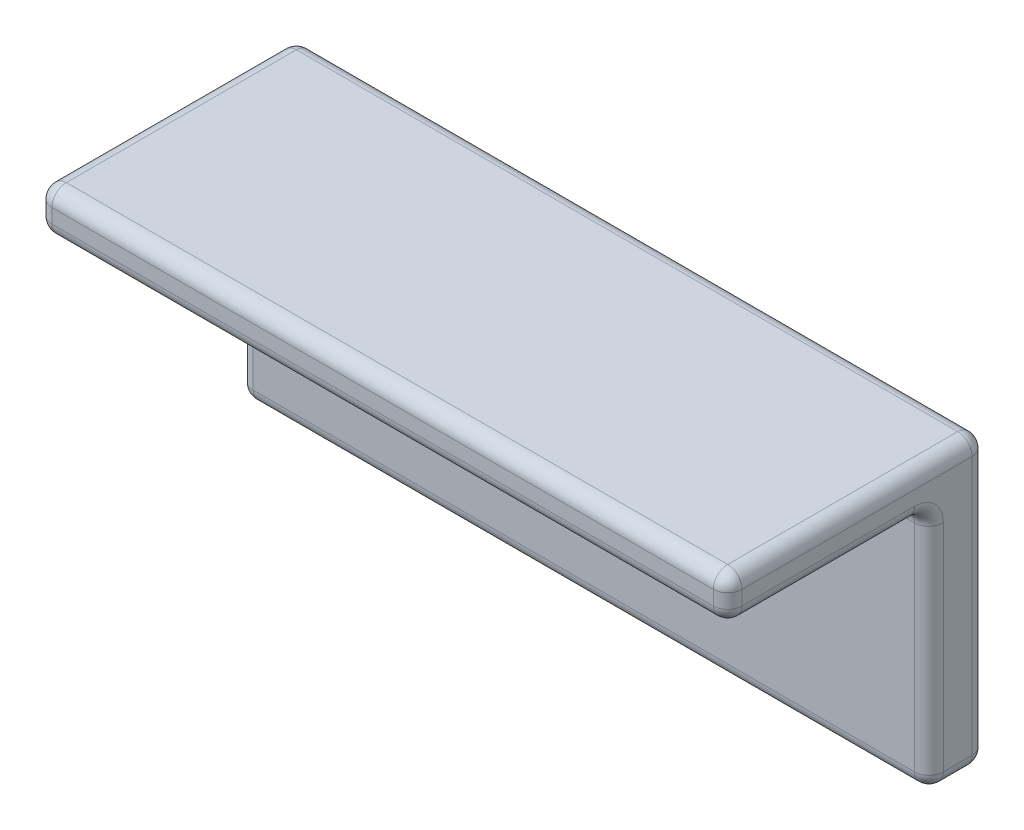
from build123d import *

# Parameters (mm, degrees)
CROQUIS1_W              = 24
CROQUIS1_H              = 10
CROQUIS1_R              = 1.75
SALIENTE_EXTRUIR1_DEPTH = 2
CROQUIS2_W              = 24
CROQUIS2_H              = 1.5
SALIENTE_EXTRUIR2_DEPTH = 7
REDONDEO1_R             = 0.5


with BuildPart() as part:
    # Croquis1 → Saliente-Extruir1 (new body)
    with BuildSketch(Plane.XY):
        with Locations((12, 5)):
            Rectangle(CROQUIS1_W, CROQUIS1_H)
        with Locations((12, 5)):
            Circle(CROQUIS1_R, mode=Mode.SUBTRACT)
    extrude(amount=SALIENTE_EXTRUIR1_DEPTH)

    # Croquis2 → Saliente-Extruir2 (add)
    with BuildSketch(Plane.XY.offset(2)):
        with Locations((12, 9.25)):
            Rectangle(CROQUIS2_W, CROQUIS2_H)
    extrude(amount=SALIENTE_EXTRUIR2_DEPTH)

    # Redondeo1
    redondeo1_edges = [part.edges().sort_by_distance(p)[0] for p in [
        (10.25, 5, 0),
        (10.25, 5, 2),
        (24, 4.25, 2),
        (0, 4.25, 2),
        (24, 8.5, 5.5),
        (12, 8.5, 2),
        (0, 8.5, 5.5),
        (24, 9.25, 9),
        (12, 10, 9),
        (0, 9.25, 9),
        (12, 8.5, 9),
        (12, 10, 0),
        (24, 5, 0),
        (12, 0, 0),
        (0, 5, 0),
        (0, 10, 4.5),
        (24, 10, 4.5),
        (24, 0, 1),
        (0, 0, 1),
        (12, 0, 2),
    ]]
    fillet(redondeo1_edges, radius=REDONDEO1_R)


solid = part.part
